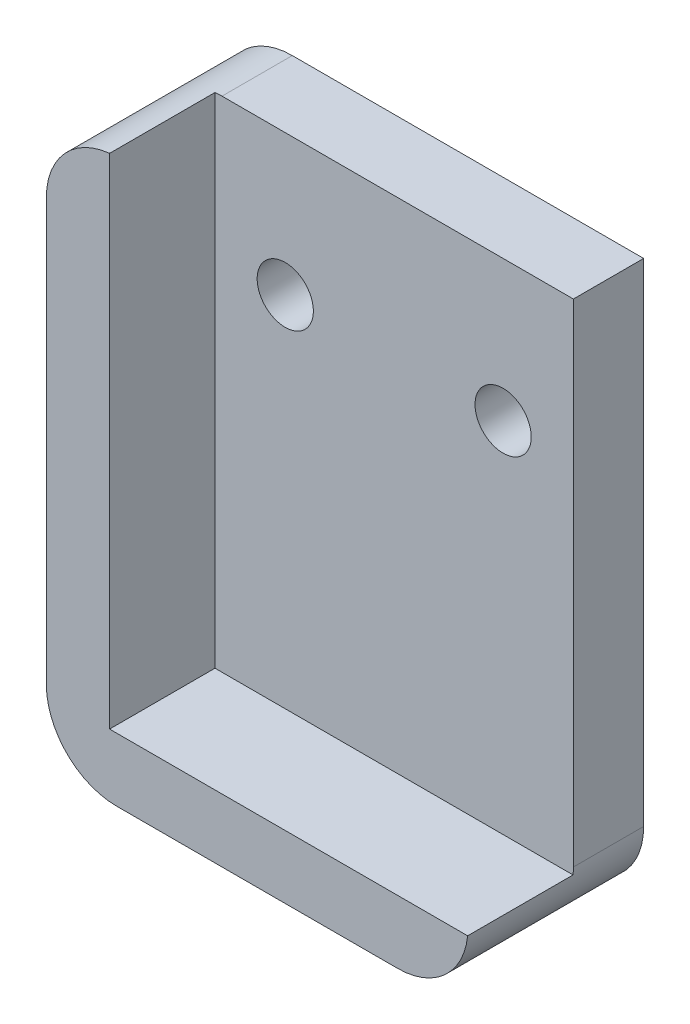
from build123d import *

# Parameters (mm, degrees)
SKETCH1_W           = 60
SKETCH1_H           = 80
BOSS_EXTRUDE4_DEPTH = 10
BOSS_EXTRUDE5_DEPTH = 25
SKETCH1_15_R        = 2
CUT_EXTRUDE1_DEPTH  = 25
SKETCH1_16_R        = 4
SKETCH1_16_R_2      = 2
CUT_EXTRUDE2_DEPTH  = 25
SKETCH1_18_R        = 4
SKETCH1_18_R_2      = 2
BOSS_EXTRUDE7_DEPTH = 4
FILLET1_R           = 10


with BuildPart() as part:
    # Sketch1 → Boss-Extrude4 (new body)
    with BuildSketch(Plane.XY):
        with Locations((30, 40)):
            Rectangle(SKETCH1_W, SKETCH1_H)
    extrude(amount=BOSS_EXTRUDE4_DEPTH)

    # Sketch1<12> → Boss-Extrude5 (add)
    with BuildSketch(Plane.XY):
        Polygon((9, 9), (9, 80), (0, 80), (0, 0), (60, 0), (60, 9), align=None)
    extrude(amount=BOSS_EXTRUDE5_DEPTH)

    # Sketch1<15> → Cut-Extrude1 (cut)
    with BuildSketch(Plane.XY):
        with Locations((50, 60)):
            Circle(SKETCH1_15_R)
        with Locations((19, 60)):
            Circle(SKETCH1_15_R)
    extrude(amount=CUT_EXTRUDE1_DEPTH, mode=Mode.SUBTRACT)

    # Sketch1<16> → Cut-Extrude2 (cut)
    # profile 1 of 2: a face of its own
    with BuildSketch(Plane.XY):
        with Locations((19, 60)):
            Circle(SKETCH1_16_R)
        with Locations((19, 60)):
            Circle(SKETCH1_16_R_2, mode=Mode.SUBTRACT)
    # profile 2 of 2: a face of its own
    with BuildSketch(Plane.XY):
        with Locations((50, 60)):
            Circle(SKETCH1_16_R)
        with Locations((50, 60)):
            Circle(SKETCH1_16_R_2, mode=Mode.SUBTRACT)
    extrude(amount=CUT_EXTRUDE2_DEPTH, mode=Mode.SUBTRACT)

    # Sketch1<18> → Boss-Extrude7 (add)
    # profile 1 of 2: a face of its own
    with BuildSketch(Plane.XY):
        with Locations((19, 60)):
            Circle(SKETCH1_18_R)
        with Locations((19, 60)):
            Circle(SKETCH1_18_R_2, mode=Mode.SUBTRACT)
    # profile 2 of 2: a face of its own
    with BuildSketch(Plane.XY):
        with Locations((50, 60)):
            Circle(SKETCH1_18_R)
        with Locations((50, 60)):
            Circle(SKETCH1_18_R_2, mode=Mode.SUBTRACT)
    extrude(amount=BOSS_EXTRUDE7_DEPTH)

    # Fillet1
    fillet1_edges = [part.edges().sort_by_distance(p)[0] for p in [
        (60, 0, 12.5),
        (0, 80, 12.5),
        (0, 0, 12.5),
    ]]
    fillet(fillet1_edges, radius=FILLET1_R)


solid = part.part
